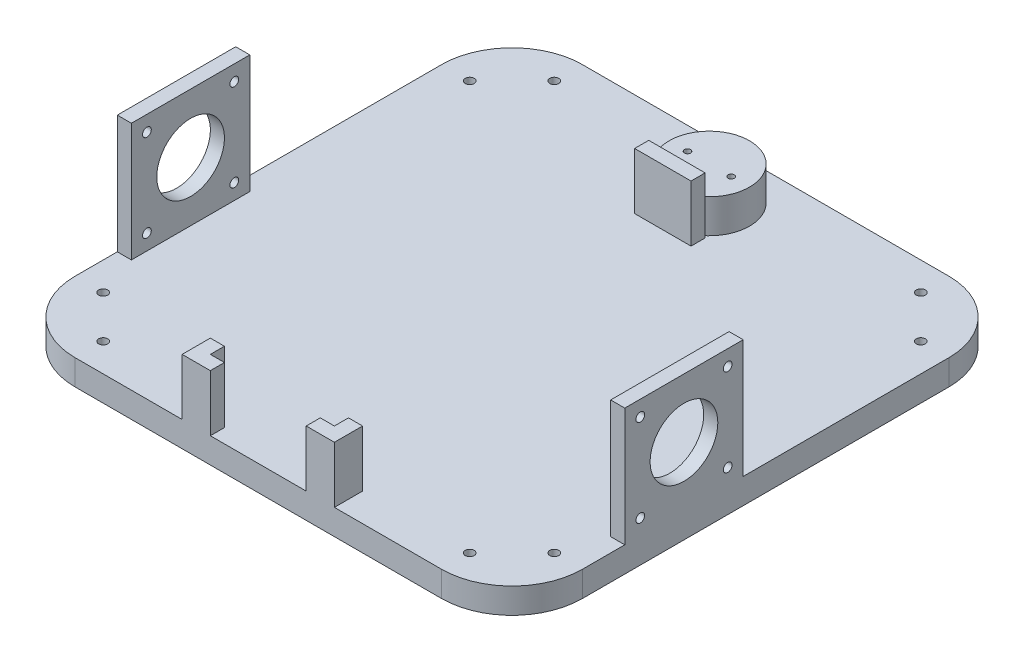
from build123d import *

# Parameters (mm, degrees)
PLATE_DEPTH             = 9
SKETCH3_R               = 1.6
HEX_HOLES_DEPTH         = 128.597021909
SKETCH4_W               = 20
SKETCH4_H               = 5
BATTERY_HOLDER_DEPTH    = 20
SKETCH5_W               = 42
SKETCH5_H               = 42
SKETCH5_R               = 12
SKETCH5_R_2             = 1.55
BOSS_EXTRUDE2_DEPTH     = 5
BOSS_EXTRUDE3_START     = -5
SKETCH6_W               = 42
SKETCH6_H               = 42
SKETCH6_R               = 12
SKETCH6_R_2             = 1.55
BOSS_EXTRUDE3_DEPTH     = 5
SKETCH8_R               = 14.25
BOSS_EXTRUDE4_DEPTH     = 12
SKETCH7_R               = 11.75
CUT_EXTRUDE1_DEPTH      = 10.6
CASTER_HOLES_DEPTH      = 135.029847422
CASTER_HOLES_DEPTH_BACK = 135.029847422
SKETCH2_R               = 1.09


with BuildPart() as part:
    # Sketch1 → Plate (new body)
    with BuildSketch(Plane(origin=(0, 0, 0), x_dir=(1, 0, 0), z_dir=(0, 1, 0))):
        with BuildLine():
            Line((-65, -90), (65, -90))
            ThreePointArc((65, -90), (82.67766953, -82.67766953), (90, -65))
            Line((90, -65), (90, 65))
            ThreePointArc((90, 65), (82.67766953, 82.67766953), (65, 90))
            Line((65, 90), (-65, 90))
            ThreePointArc((-65, 90), (-82.67766953, 82.67766953), (-90, 65))
            Line((-90, 65), (-90, -65))
            ThreePointArc((-90, -65), (-82.67766953, -82.67766953), (-65, -90))
        make_face()
    extrude(amount=PLATE_DEPTH)

    # Sketch3 → Hex Holes (cut, through all)
    with BuildSketch(Plane(origin=(0, 9, 0), x_dir=(1, 0, 0), z_dir=(0, 1, 0))):
        with Locations(Location((-65, 80, 0), (0, 0, 270))):
            Circle(SKETCH3_R)
        with Locations(Location((-80, 65, 0), (0, 0, 270))):
            Circle(SKETCH3_R)
        with Locations(Location((80, 65, 0), (0, 0, 270))):
            Circle(SKETCH3_R)
        with Locations(Location((80, -65, 0), (0, 0, 270))):
            Circle(SKETCH3_R)
        with Locations(Location((65, 80, 0), (0, 0, 270))):
            Circle(SKETCH3_R)
        with Locations(Location((65, -80, 0), (0, 0, 270))):
            Circle(SKETCH3_R)
        with Locations(Location((-65, -80, 0), (0, 0, 270))):
            Circle(SKETCH3_R)
        with Locations(Location((-80, -65, 0), (0, 0, 270))):
            Circle(SKETCH3_R)
    extrude(amount=-HEX_HOLES_DEPTH, mode=Mode.SUBTRACT)

    # Sketch4 → Battery Holder (add)
    with BuildSketch(Plane(origin=(0, 9, 0), x_dir=(1, 0, 0), z_dir=(0, 1, 0))):
        Polygon((-22, -85), (-17, -85), (-17, -90), (-27, -90), (-27, -80), (-22, -80), align=None)
        Polygon((17, -85), (22, -85), (22, -80), (27, -80), (27, -90), (17, -90), align=None)
        with Locations((0, 56)):
            Rectangle(SKETCH4_W, SKETCH4_H)
    extrude(amount=BATTERY_HOLDER_DEPTH)

    # Sketch5 → Boss-Extrude2 (add)
    with BuildSketch(Plane.ZY.offset(90)):
        with Locations((29, 30)):
            Rectangle(SKETCH5_W, SKETCH5_H)
        with Locations((29, 30)):
            Circle(SKETCH5_R, mode=Mode.SUBTRACT)
        with Locations((13.5, 45.5)):
            Circle(SKETCH5_R_2, mode=Mode.SUBTRACT)
        with Locations((44.5, 45.5)):
            Circle(SKETCH5_R_2, mode=Mode.SUBTRACT)
        with Locations((44.5, 14.5)):
            Circle(SKETCH5_R_2, mode=Mode.SUBTRACT)
        with Locations((13.5, 14.5)):
            Circle(SKETCH5_R_2, mode=Mode.SUBTRACT)
    extrude(amount=-BOSS_EXTRUDE2_DEPTH)

    # Sketch6 → Boss-Extrude3 (add)
    with BuildSketch(Plane(origin=(90, 0, 0), x_dir=(0, 0, -1), z_dir=(1, 0, 0)).offset(BOSS_EXTRUDE3_START)):
        with Locations((-29, 30)):
            Rectangle(SKETCH6_W, SKETCH6_H)
        with Locations(Location((-29, 30, 0), (0, 0, 180))):
            Circle(SKETCH6_R, mode=Mode.SUBTRACT)
        with Locations(Location((-44.5, 45.5, 0), (0, 0, 180))):
            Circle(SKETCH6_R_2, mode=Mode.SUBTRACT)
        with Locations(Location((-13.5, 45.5, 0), (0, 0, 180))):
            Circle(SKETCH6_R_2, mode=Mode.SUBTRACT)
        with Locations(Location((-13.5, 14.5, 0), (0, 0, 180))):
            Circle(SKETCH6_R_2, mode=Mode.SUBTRACT)
        with Locations(Location((-44.5, 14.5, 0), (0, 0, 180))):
            Circle(SKETCH6_R_2, mode=Mode.SUBTRACT)
    extrude(amount=BOSS_EXTRUDE3_DEPTH)

    # Sketch8 → Boss-Extrude4 (add)
    with BuildSketch(Plane(origin=(0, 9, 0), x_dir=(1, 0, 0), z_dir=(0, 1, 0))):
        with Locations((0, 70)):
            Circle(SKETCH8_R)
    extrude(amount=BOSS_EXTRUDE4_DEPTH)

    # Sketch7 → Cut-Extrude1 (cut)
    with BuildSketch(Plane.XZ):
        with Locations(Location((0, -70, 0), (0, 0, 270))):
            Circle(SKETCH7_R)
    extrude(amount=-CUT_EXTRUDE1_DEPTH, mode=Mode.SUBTRACT)

    # Sketch2 → Caster Holes (cut, two sides: drawn at the far end of the back side and taken through both)
    with BuildSketch(Plane(origin=(0, 9, 0), x_dir=(1, 0, 0), z_dir=(0, 1, 0)).offset(-CASTER_HOLES_DEPTH_BACK)):
        with Locations(Location((-7.747, 70, 0), (0, 0, 270))):
            Circle(SKETCH2_R)
        with Locations(Location((7.747, 70, 0), (0, 0, 270))):
            Circle(SKETCH2_R)
    extrude(amount=CASTER_HOLES_DEPTH + CASTER_HOLES_DEPTH_BACK, mode=Mode.SUBTRACT)


solid = part.part
